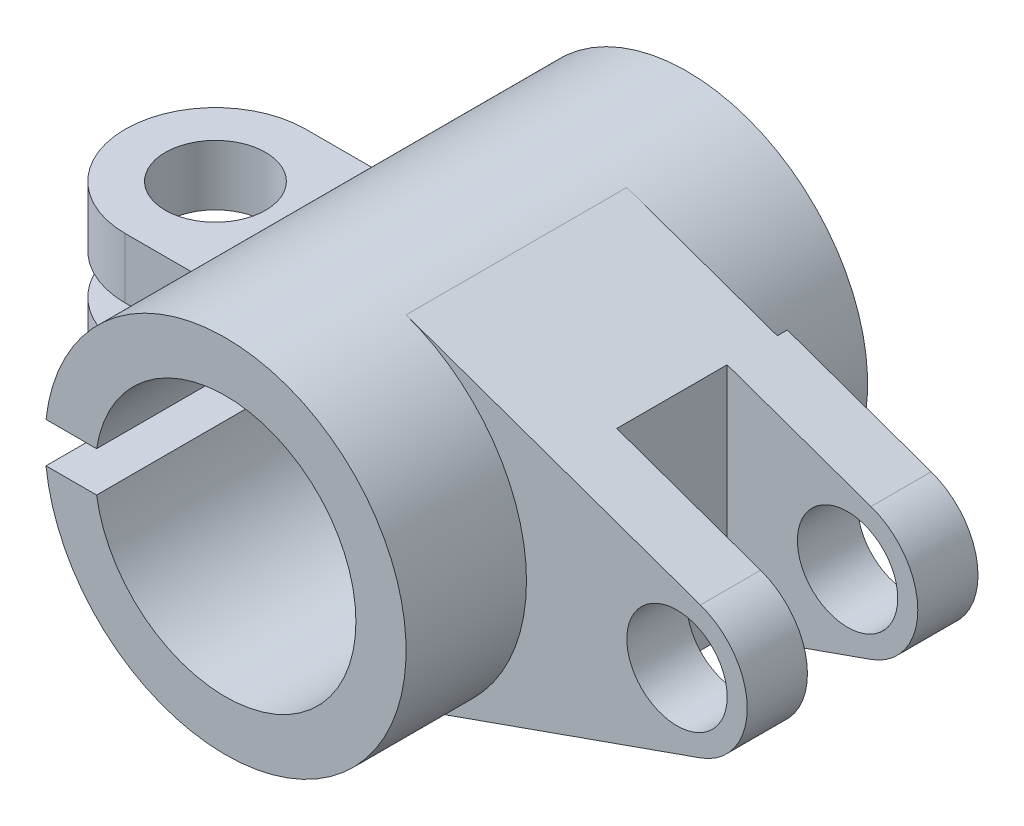
from build123d import *

# Parameters (mm, degrees)
BOSS_EXTRUDE1_DEPTH    = 23
BOSS_EXTRUDE2_DEPTH    = 11
BOSS_EXTRUDE3_START    = 5
SKETCH1_4_R            = 5
BOSS_EXTRUDE3_DEPTH    = 6
BOSS_EXTRUDE4_START    = -12
SKETCH1_5_R            = 5
BOSS_EXTRUDE4_DEPTH    = 6
BOSS_EXTRUDE5_DEPTH    = 9
FILLET1_RADIUS         = 9
FILLET1_LENGTH         = 6
FILLET2_RADIUS         = 9
FILLET2_LENGTH         = 6
F_10_0MM_DOWEL_HOLE1_D = 10


with BuildPart() as part:
    # Sketch1 → Boss-Extrude1 (new, symmetric)
    with BuildSketch(Plane.XY):
        with BuildLine():
            ThreePointArc((6, 16.970562748), (-6.763446053, 16.681001094), (-16.124515497, 8))
            ThreePointArc((-16.124515497, 8), (-17.269106839, 5.077198931), (-17.88854382, 2))
            Line((-17.88854382, 2), (-12.845232579, 2))
            ThreePointArc((-12.845232579, 2), (13, 0), (-12.845232579, -2))
            Line((-12.845232579, -2), (-17.88854382, -2))
            ThreePointArc((-17.88854382, -2), (-17.269106839, -5.077198931), (-16.124515497, -8))
            ThreePointArc((-16.124515497, -8), (-6.763446053, -16.681001094), (6, -16.970562748))
            ThreePointArc((6, -16.970562748), (18, 0), (6, 16.970562748))
        make_face()
    extrude(amount=BOSS_EXTRUDE1_DEPTH, both=True)

    # Sketch1<3> → Boss-Extrude2 (add, symmetric)
    with BuildSketch(Plane.XY):
        with BuildLine():
            Line((21, 11.66726189), (6, 16.970562748))
            ThreePointArc((6, 16.970562748), (18, 0), (6, -16.970562748))
            Line((6, -16.970562748), (21, -11.66726189))
            Line((21, -11.66726189), (21, 11.66726189))
        make_face()
    extrude(amount=BOSS_EXTRUDE2_DEPTH, both=True)

    # Sketch1<4> → Boss-Extrude3 (add)
    with BuildSketch(Plane.XY.offset(BOSS_EXTRUDE3_START)):
        with BuildLine():
            Line((35.333333333, 6.599663291), (21, 11.66726189))
            Line((21, 11.66726189), (21, -11.66726189))
            Line((21, -11.66726189), (35.333333333, -6.599663291))
            ThreePointArc((35.333333333, -6.599663291), (40, 0), (35.333333333, 6.599663291))
        make_face()
        with Locations((33, 0)):
            Circle(SKETCH1_4_R, mode=Mode.SUBTRACT)
    extrude(amount=BOSS_EXTRUDE3_DEPTH)

    # Sketch1<5> → Boss-Extrude4 (add)
    with BuildSketch(Plane.XY.offset(BOSS_EXTRUDE4_START)):
        with BuildLine():
            Line((35.333333333, 6.599663291), (21, 11.66726189))
            Line((21, 11.66726189), (21, -11.66726189))
            Line((21, -11.66726189), (35.333333333, -6.599663291))
            ThreePointArc((35.333333333, -6.599663291), (40, 0), (35.333333333, 6.599663291))
        make_face()
        with Locations((33, 0)):
            Circle(SKETCH1_5_R, mode=Mode.SUBTRACT)
    extrude(amount=BOSS_EXTRUDE4_DEPTH)

    # Sketch1<6> → Boss-Extrude5 (add, symmetric)
    with BuildSketch(Plane.XY):
        with BuildLine():
            ThreePointArc((-17.88854382, 2), (-17.269106839, 5.077198931), (-16.124515497, 8))
            Line((-16.124515497, 8), (-33, 8))
            Line((-33, 8), (-33, 2))
            Line((-33, 2), (-17.88854382, 2))
        make_face()
        with BuildLine():
            Line((-33, -8), (-16.124515497, -8))
            ThreePointArc((-16.124515497, -8), (-17.269106839, -5.077198931), (-17.88854382, -2))
            Line((-17.88854382, -2), (-33, -2))
            Line((-33, -2), (-33, -8))
        make_face()
    extrude(amount=BOSS_EXTRUDE5_DEPTH, both=True)

    # Fillet1: full round fillet: the end face becomes a half cylinder, R = half its width
    fillet1_face = Plane((-33, 5, 0), x_dir=(0, -1, 0), z_dir=(-1, 0, 0))  # on the end face: x along it, z out of the body
    fillet1_slab = fillet1_face.offset(-FILLET1_RADIUS / 2) * Box(FILLET1_LENGTH, 2 * FILLET1_RADIUS, FILLET1_RADIUS, mode=Mode.PRIVATE)  # the body's end, R deep
    fillet1_round = Plane((-24, 5, 0), x_dir=(-1, 0, 0), z_dir=(0, -1, 0)) * Cylinder(FILLET1_RADIUS, FILLET1_LENGTH, mode=Mode.PRIVATE)  # its axis R under the face
    add(fillet1_slab - fillet1_round, mode=Mode.SUBTRACT)

    # Fillet2: full round fillet: the end face becomes a half cylinder, R = half its width
    fillet2_face = Plane((-33, -5, 0), x_dir=(0, 1, 0), z_dir=(-1, 0, 0))  # on the end face: x along it, z out of the body
    fillet2_slab = fillet2_face.offset(-FILLET2_RADIUS / 2) * Box(FILLET2_LENGTH, 2 * FILLET2_RADIUS, FILLET2_RADIUS, mode=Mode.PRIVATE)  # the body's end, R deep
    fillet2_round = Plane((-24, -5, 0), x_dir=(-1, 0, 0), z_dir=(0, 1, 0)) * Cylinder(FILLET2_RADIUS, FILLET2_LENGTH, mode=Mode.PRIVATE)  # its axis R under the face
    add(fillet2_slab - fillet2_round, mode=Mode.SUBTRACT)

    # Ø10.0mm Dowel Hole1 (through all)
    with Locations(Plane(origin=(-24, 8, 0), x_dir=(1, 0, 0), z_dir=(0, 1, 0))):
        with Locations((0, 0)):
            Hole(F_10_0MM_DOWEL_HOLE1_D / 2)


solid = part.part
